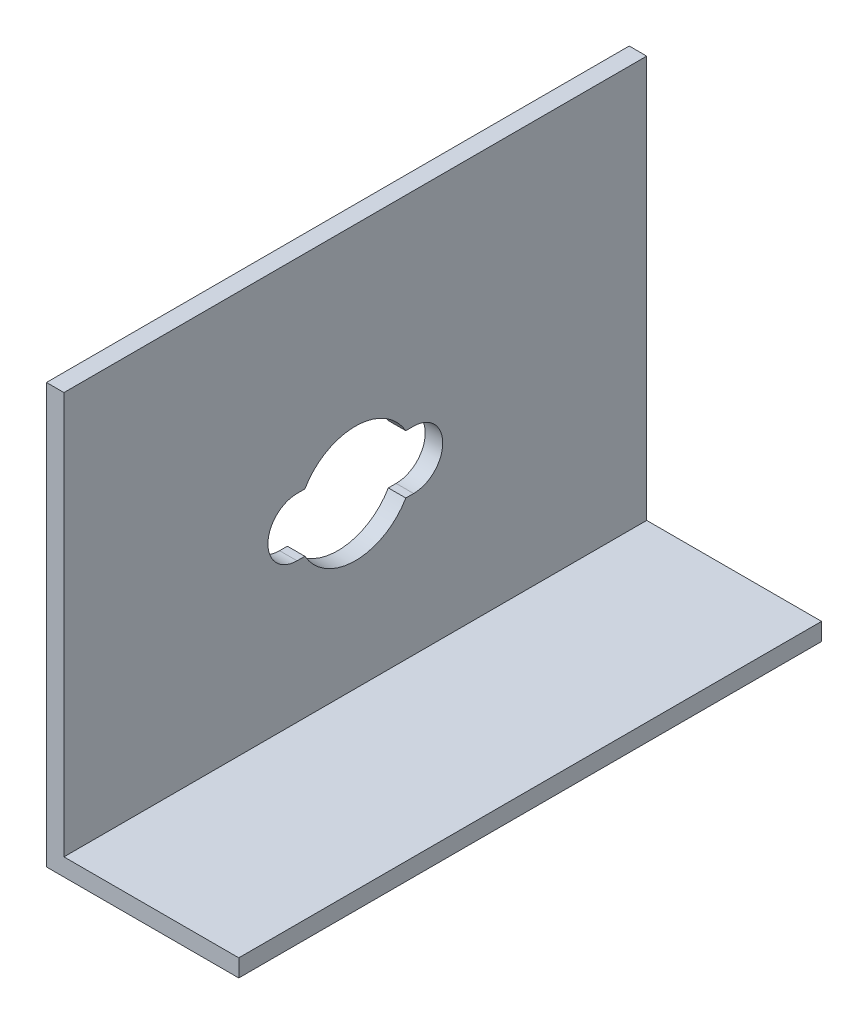
from build123d import *

# Parameters (mm, degrees)
BOSS_EXTRUDE1_DEPTH = 100
CUT_EXTRUDE1_DEPTH  = 100


with BuildPart() as part:
    # Sketch1 → Boss-Extrude1 (new body)
    with BuildSketch(Plane.XY):
        Polygon((0, 72), (3, 72), (3, 3), (33, 3), (33, 0), (0, 0), align=None)
    extrude(amount=BOSS_EXTRUDE1_DEPTH)

    # Sketch2 → Cut-Extrude1 (cut)
    with BuildSketch(Plane.ZY):
        with BuildLine():
            Line((58.660254038, 37), (60, 37))
            ThreePointArc((60, 37), (65, 32), (60, 27))
            Line((60, 27), (58.660254038, 27))
            ThreePointArc((58.660254038, 27), (50, 22), (41.339745962, 27))
            Line((41.339745962, 27), (40, 27))
            ThreePointArc((40, 27), (35, 32), (40, 37))
            Line((40, 37), (41.339745962, 37))
            ThreePointArc((41.339745962, 37), (50, 42), (58.660254038, 37))
        make_face()
    extrude(amount=-CUT_EXTRUDE1_DEPTH, mode=Mode.SUBTRACT)


solid = part.part
